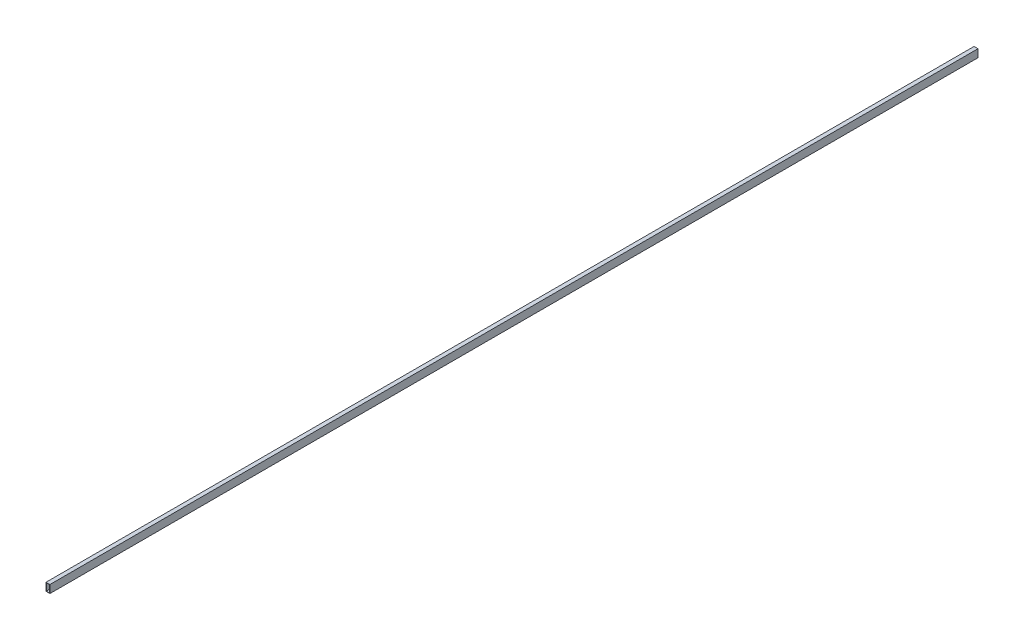
from build123d import *

# Parameters (mm, degrees)
CROQUIS1_W              = 25.4
CROQUIS1_H              = 50.8
CROQUIS1_W_2            = 21.62
CROQUIS1_H_2            = 47.02
SALIENTE_EXTRUIR1_DEPTH = 6000


with BuildPart() as part:
    # Croquis1 → Saliente-Extruir1 (new body)
    with BuildSketch(Plane.XY):
        Rectangle(CROQUIS1_W, CROQUIS1_H)
        Rectangle(CROQUIS1_W_2, CROQUIS1_H_2, mode=Mode.SUBTRACT)
    extrude(amount=SALIENTE_EXTRUIR1_DEPTH)


solid = part.part
